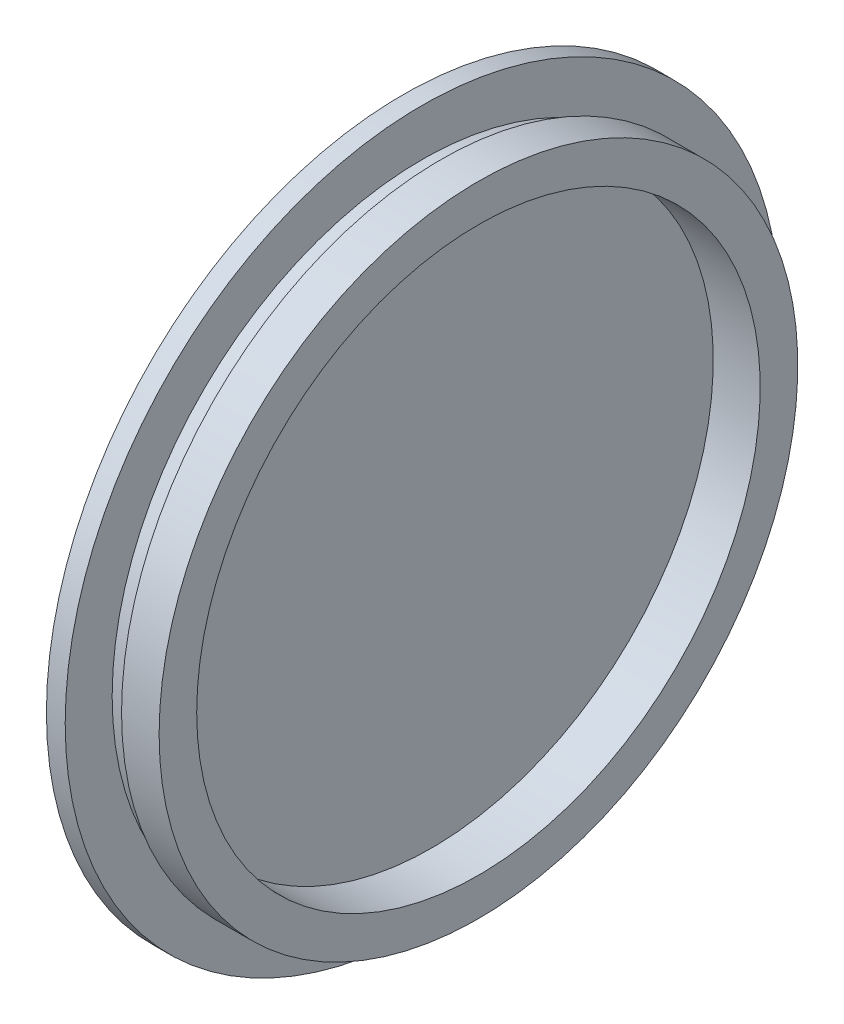
from build123d import *

# Parameters (mm, degrees)
SKETCH2_R          = 1
CUT_EXTRUDE1_DEPTH = 1


with BuildPart() as part:
    # Sketch1 → Revolve1 (revolve)
    with BuildSketch(Plane.XY, mode=Mode.PRIVATE) as revolve1_sk:
        Polygon((0, 19), (1, 19), (1, 16.5), (2, 16.5), (2, 17), (4, 17), (4, 15), (1.5, 15), (1.5, 0), (0, 0), align=None)
    revolve(revolve1_sk.sketch.rotate(Axis((0, 0, 0), (1, 0, 0)), 90), axis=Axis((0, 0, 0), (1, 0, 0)))

    # Sketch2 → Cut-Extrude1 (cut)
    with BuildSketch(Plane.ZY):
        with Locations((-10, 0)):
            Circle(SKETCH2_R)
        with Locations((0, 10)):
            Circle(SKETCH2_R)
        with Locations((10, 0)):
            Circle(SKETCH2_R)
        with Locations((0, -10)):
            Circle(SKETCH2_R)
    extrude(amount=-CUT_EXTRUDE1_DEPTH, mode=Mode.SUBTRACT)


solid = part.part
